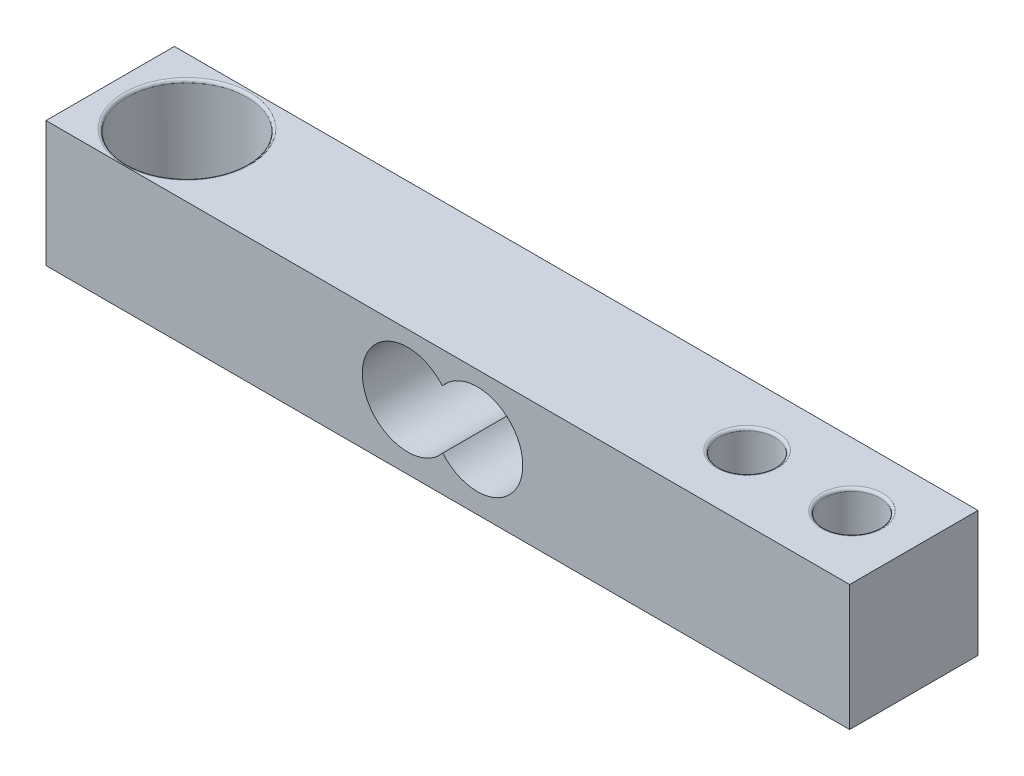
from build123d import *

# Parameters (mm, degrees)
SKETCH_1_W          = 57.566503366
SKETCH_1_H          = 9.194649843
EXTRUDE_2_DEPTH     = 9
SKETCH_2_R          = 4.304670881
CUT_EXTRUDE_1_DEPTH = 9
SKETCH_3_R          = 3.25
CUT_EXTRUDE_4_DEPTH = 59.986811199
SKETCH_4_R          = 1.995507564
CUT_EXTRUDE_5_DEPTH = 59.986811199
FILLET_4_R          = 0.2


with BuildPart() as part:
    # 草图1 → 凸台-拉伸2 (new body)
    with BuildSketch(Plane(origin=(0, 0, 0), x_dir=(1, 0, 0), z_dir=(0, 1, 0))):
        with Locations((28.783251683, 4.597324922)):
            Rectangle(SKETCH_1_W, SKETCH_1_H)
    extrude(amount=EXTRUDE_2_DEPTH)

    # 草图2 → 切除-拉伸1 (cut)
    with BuildSketch(Plane(origin=(0, 9, 0), x_dir=(1, 0, 0), z_dir=(0, 1, 0))):
        with Locations(Location((5.562922539, 4.537375707, 0), (0, 0, 270))):
            Circle(SKETCH_2_R)
    extrude(amount=-CUT_EXTRUDE_1_DEPTH, mode=Mode.SUBTRACT)

    # 草图3 → 切除-拉伸4 (cut, through all)
    with BuildSketch(Plane.XY):
        with Locations((25.905689379, 4.639881501)):
            Circle(SKETCH_3_R)
        with Locations((30.901457267, 4.679847644)):
            Circle(SKETCH_3_R)
    extrude(amount=-CUT_EXTRUDE_4_DEPTH, mode=Mode.SUBTRACT)

    # 草图4 → 切除-拉伸5 (cut, through all)
    with BuildSketch(Plane(origin=(0, 9, 0), x_dir=(1, 0, 0), z_dir=(0, 1, 0))):
        with Locations(Location((45.569031787, 4.648915429, 0), (0, 0, 270))):
            Circle(SKETCH_4_R)
        with Locations(Location((53.08266669, 4.648915429, 0), (0, 0, 270))):
            Circle(SKETCH_4_R)
    extrude(amount=-CUT_EXTRUDE_5_DEPTH, mode=Mode.SUBTRACT)

    # 圆角4
    fillet_4_edges = [part.edges().sort_by_distance(p)[0] for p in [
        (5.562922539, 9, -8.842046587),
        (45.569031787, 9, -6.644422993),
        (53.08266669, 9, -6.644422993),
    ]]
    fillet(fillet_4_edges, radius=FILLET_4_R)


solid = part.part
